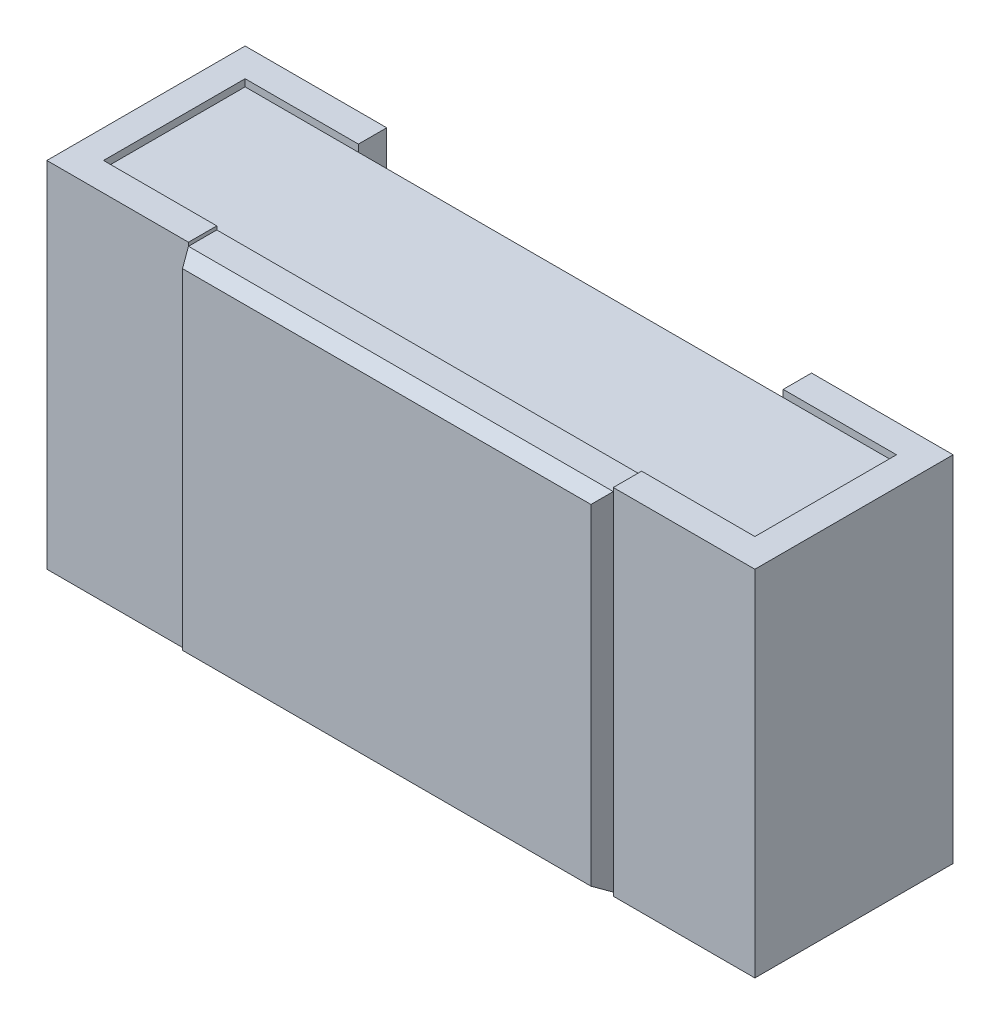
from build123d import *

# Parameters (mm, degrees)
EXTRUDE_START             = 0.04
SKETCH_2_W                = 0.92
SKETCH_2_H                = 0.48
EXTRUDE_2_DEPTH           = 0.2
EXTRUDE_4_DEPTH           = 0.25
EXTRUDE_4_DEPTH_BACK      = 0.25
EXTRUDE_START_2           = 0.28
SKETCH_6_W                = 0.6
SKETCH_6_H                = 0.49
EXTRUDE_6_DEPTH           = 0.02
EXTRUDE_6_TAPER           = 30
EXTRUDE_6_OTHER_WAY_DEPTH = 0.04


with BuildPart() as part:
    # Эскиз2 → Вытянуть2 (new body)
    with BuildSketch(Plane.XY.offset(EXTRUDE_START)):
        Rectangle(SKETCH_2_W, SKETCH_2_H)
    extrude(amount=EXTRUDE_2_DEPTH)

    # Эскиз4 → Вытянуть4 (add, two sides: drawn at the far end of the back side and taken through both)
    with BuildSketch(Plane(origin=(0, 0, 0), x_dir=(1, 0, 0), z_dir=(0, 1, 0)).offset(-EXTRUDE_4_DEPTH_BACK)):
        Polygon((-0.5, 0), (-0.3, 0), (-0.3, -0.04), (-0.46, -0.04), (-0.46, -0.24), (-0.3, -0.24), (-0.3, -0.28), (-0.5, -0.28), align=None)
        Polygon((0.3, -0.24), (0.46, -0.24), (0.46, -0.04), (0.3, -0.04), (0.3, 0), (0.5, 0), (0.5, -0.28), (0.3, -0.28), align=None)
    extrude(amount=EXTRUDE_4_DEPTH + EXTRUDE_4_DEPTH_BACK)

    # Эскиз6 → Вытянуть6 (add)
    with BuildSketch(Plane.XY.offset(EXTRUDE_START_2)):
        Rectangle(SKETCH_6_W, SKETCH_6_H)
    extrude(amount=EXTRUDE_6_DEPTH, taper=EXTRUDE_6_TAPER)

    # Эскиз6 → Вытянуть6 other way (add)
    with BuildSketch(Plane.XY.offset(EXTRUDE_START_2)):
        Rectangle(SKETCH_6_W, SKETCH_6_H)
    extrude(amount=-EXTRUDE_6_OTHER_WAY_DEPTH)


solid = part.part
